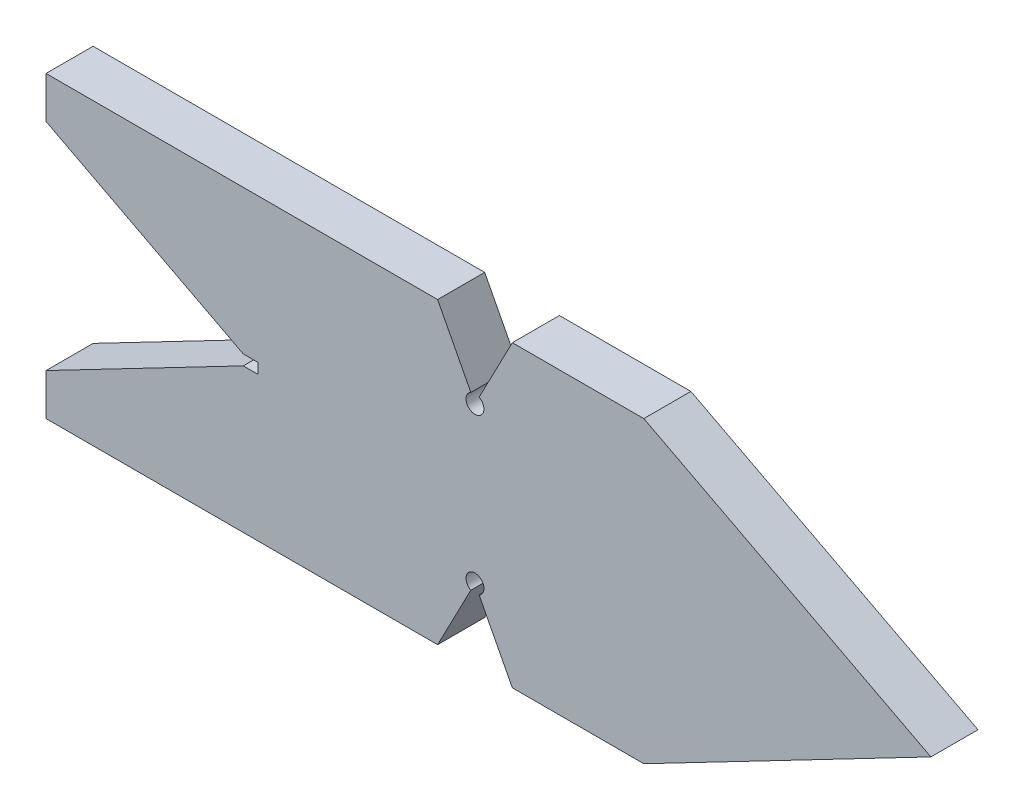
from build123d import *

# Parameters (mm, degrees)
BOSS_EXTRUDE1_DEPTH = 4
CUT_EXTRUDE1_DEPTH  = 1


with BuildPart() as part:
    # Sketch1 → Boss-Extrude1 (new body)
    with BuildSketch(Plane(origin=(0, 0, 0), x_dir=(-1, 0, 0), z_dir=(0, 0, -1))):
        with BuildLine():
            Line((-33.277650511, 0), (0, 0))
            Line((0, 0), (0, 3.534564477))
            Line((0, 3.534564477), (-16.761519211, 12.260059095))
            Line((-16.761519211, 12.260059095), (-18.031519211, 12.260059095))
            Line((-18.031519211, 12.260059095), (-18.031519211, 13.139940905))
            Line((-18.031519211, 13.139940905), (-16.761519211, 13.139940905))
            Line((-16.761519211, 13.139940905), (0, 21.865435523))
            Line((0, 21.865435523), (0, 25.4))
            Line((0, 25.4), (-33.277650511, 25.4))
            Line((-33.277650511, 25.4), (-36.100798067, 19.976784002))
            ThreePointArc((-36.100798067, 19.976784002), (-36.452650511, 18.538881747), (-36.804502954, 19.976784002))
            Line((-36.804502954, 19.976784002), (-39.627650511, 25.4))
            Line((-39.627650511, 25.4), (-50.8, 25.4))
            Line((-50.8, 25.4), (-75.196473013, 12.7))
            Line((-75.196473013, 12.7), (-50.8, 0))
            Line((-50.8, 0), (-39.627650511, 0))
            Line((-39.627650511, 0), (-36.804502954, 5.423215998))
            ThreePointArc((-36.804502954, 5.423215998), (-36.452650511, 6.861118253), (-36.100798067, 5.423215998))
            Line((-36.100798067, 5.423215998), (-33.277650511, 0))
        make_face()
    extrude(amount=-BOSS_EXTRUDE1_DEPTH)

    # Sketch2 → Cut-Extrude1 (cut)
    with BuildSketch(Plane(origin=(0, 0, 0), x_dir=(-1, 0, 0), z_dir=(0, 0, -1))):
        with BuildLine():
            Line((-37.434135709, 15.206613971), (-37.434135709, 14.847639612))
            Line((-37.434135709, 14.847639612), (-38.624640517, 14.847639612))
            Line((-38.624640517, 14.847639612), (-38.81324228, 13.927066695))
            add(Edge.make_bspline(
                [(-38.81324228, 13.927066695), (-38.776186405, 13.937296967), (-38.70439651, 13.957116501), (-38.598436649, 13.979122271), (-38.497844445, 13.992387715), (-38.432569075, 13.994199026), (-38.400982664, 13.99507551)],
                knots=[0, 0, 0, 0, 1.100273476, 2.13160584, 3.095893838, 4, 4, 4, 4], degree=3))
            add(Edge.make_bspline(
                [(-38.400982664, 13.99507551), (-38.361898925, 13.994229574), (-38.285050527, 13.992566253), (-38.17261158, 13.976594404), (-38.065278687, 13.951454489), (-37.963276317, 13.916333967), (-37.866415766, 13.871424234), (-37.775588205, 13.815324294), (-37.689430292, 13.749790962), (-37.609487698, 13.67444595), (-37.53696339, 13.591524334), (-37.4731974, 13.502366463), (-37.41903481, 13.407838801), (-37.375474055, 13.307038192), (-37.340689721, 13.201079038), (-37.317537726, 13.088846456), (-37.302121017, 12.971398336), (-37.30039863, 12.891093766), (-37.299520325, 12.850143619)],
                knots=[0, 0, 0, 0, 1.052922333, 2.070308379, 3.05430497, 4.020497103, 4.973039431, 5.925935799, 6.892292201, 7.88610001, 8.88166317, 9.857072816, 10.836096531, 11.812156883, 12.81219415, 13.836441305, 14.89672472, 16, 16, 16, 16], degree=3))
            add(Edge.make_bspline(
                [(-37.299520325, 12.850143619), (-37.3001854, 12.821621398), (-37.301506563, 12.764962411), (-37.30822515, 12.68081821), (-37.321160866, 12.598455377), (-37.33852859, 12.517862985), (-37.361071008, 12.439193613), (-37.388360062, 12.362222085), (-37.42175609, 12.287427478), (-37.458387465, 12.214102083), (-37.499633943, 12.143903576), (-37.54541245, 12.078254589), (-37.593777942, 12.016170308), (-37.645819327, 11.958316575), (-37.702020322, 11.905073557), (-37.761700289, 11.856125276), (-37.824383008, 11.810643945), (-37.89103825, 11.77047575), (-37.960180733, 11.733512794), (-38.03280895, 11.703189257), (-38.107269651, 11.676078728), (-38.184634527, 11.654469201), (-38.264728339, 11.637536646), (-38.347683115, 11.626036046), (-38.433063785, 11.617659608), (-38.490938797, 11.617135251), (-38.520173369, 11.616870381)],
                knots=[0, 0, 0, 0, 1.056347294, 2.098418968, 3.122841568, 4.141288669, 5.149314143, 6.15115421, 7.162517403, 8.180376062, 9.185164535, 10.17417709, 11.141909838, 12.097768115, 13.052685741, 14.0056014, 14.954263652, 15.917497458, 16.885230207, 17.854509472, 18.828990115, 19.81800267, 20.826176721, 21.857883937, 22.917946725, 24, 24, 24, 24], degree=3))
            add(Edge.make_bspline(
                [(-38.520173369, 11.616870381), (-38.55504755, 11.617561219), (-38.623658381, 11.618920361), (-38.724178948, 11.633138847), (-38.820893554, 11.653502763), (-38.913023655, 11.684139033), (-39.001394919, 11.722526328), (-39.084817636, 11.771042499), (-39.165423412, 11.826021603), (-39.239935449, 11.890901956), (-39.309091563, 11.961817638), (-39.370998071, 12.038775279), (-39.426131648, 12.120504721), (-39.473609395, 12.207402875), (-39.514107416, 12.299241406), (-39.545922405, 12.396364407), (-39.57160076, 12.498264411), (-39.58246418, 12.568417921), (-39.587981863, 12.604049869)],
                knots=[0, 0, 0, 0, 1.0467383, 2.05933395, 3.04377827, 4.011590433, 4.970194871, 5.932262533, 6.905835911, 7.896367577, 8.894135286, 9.877477877, 10.858688626, 11.851381753, 12.8477658, 13.868841284, 14.917554742, 16, 16, 16, 16], degree=3))
            Line((-39.587981863, 12.604049869), (-39.273879299, 12.604049869))
            add(Edge.make_bspline(
                [(-39.273879299, 12.604049869), (-39.266150742, 12.570673416), (-39.251296025, 12.506522021), (-39.218690276, 12.41639068), (-39.178824401, 12.336071456), (-39.131420053, 12.264501873), (-39.074870022, 12.202092876), (-39.010340593, 12.146475814), (-38.93799287, 12.096300684), (-38.85759964, 12.054477917), (-38.772786561, 12.018809164), (-38.684019351, 11.995057469), (-38.593715005, 11.978356576), (-38.532636634, 11.976684815), (-38.501944203, 11.97584474)],
                knots=[0, 0, 0, 0, 1.136247022, 2.183929868, 3.172523383, 4.106158343, 5.02341133, 5.958108904, 6.928429099, 7.938127109, 8.96079061, 9.975095812, 10.982467395, 12, 12, 12, 12], degree=3))
            add(Edge.make_bspline(
                [(-38.501944203, 11.97584474), (-38.471985758, 11.976665518), (-38.412997336, 11.978281637), (-38.32618595, 11.990720649), (-38.242373075, 12.00987822), (-38.162385719, 12.038548075), (-38.084824179, 12.073392793), (-38.011650409, 12.118107869), (-37.940747531, 12.169567888), (-37.874319398, 12.228524518), (-37.813479949, 12.293494212), (-37.759723827, 12.362971606), (-37.714946914, 12.437088452), (-37.677212805, 12.514561605), (-37.648559506, 12.596240162), (-37.628118525, 12.681741338), (-37.616115466, 12.771276318), (-37.614464286, 12.832345628), (-37.613622889, 12.863464933)],
                knots=[0, 0, 0, 0, 1.027316725, 2.022795036, 3.002884548, 3.971462791, 4.93288096, 5.914575861, 6.907176829, 7.935150275, 8.956128384, 9.956726525, 10.942570165, 11.921478529, 12.907843606, 13.90538589, 14.932640048, 16, 16, 16, 16], degree=3))
            add(Edge.make_bspline(
                [(-37.613622889, 12.863464933), (-37.614281368, 12.891540684), (-37.615570248, 12.946494973), (-37.626100818, 13.02689418), (-37.644417791, 13.102967222), (-37.669841671, 13.175081456), (-37.702121178, 13.243304898), (-37.741567491, 13.307707959), (-37.788920889, 13.367441792), (-37.843012777, 13.422534345), (-37.902270818, 13.47337922), (-37.967714561, 13.516723307), (-38.037974488, 13.553187224), (-38.112204087, 13.584655223), (-38.192168986, 13.607255968), (-38.276285618, 13.624223854), (-38.365462326, 13.634039216), (-38.426433014, 13.635401105), (-38.45777353, 13.636101151)],
                knots=[0, 0, 0, 0, 1.045622112, 2.046656509, 3.013763289, 3.955457236, 4.890082067, 5.820317437, 6.762574623, 7.722996705, 8.69280354, 9.665887285, 10.63943826, 11.638615906, 12.663482002, 13.728887084, 14.832589034, 16, 16, 16, 16], degree=3))
            add(Edge.make_bspline(
                [(-38.45777353, 13.636101151), (-38.484902459, 13.635520559), (-38.540916814, 13.634321786), (-38.626839641, 13.625495289), (-38.717131364, 13.611255995), (-38.811445859, 13.591669747), (-38.910066367, 13.566038671), (-39.012784768, 13.53532417), (-39.119817035, 13.498602171), (-39.191934759, 13.470869957), (-39.229007504, 13.456613971)],
                knots=[0, 0, 0, 0, 0.817624296, 1.688186739, 2.600797293, 3.572016777, 4.590301741, 5.671205678, 6.80286297, 8, 8, 8, 8], degree=3))
            Line((-39.229007504, 13.456613971), (-38.870033145, 15.206613971))
            Line((-38.870033145, 15.206613971), (-37.434135709, 15.206613971))
        make_face()
        with BuildLine():
            Line((-34.741828017, 15.206613971), (-34.741828017, 14.847639612))
            Line((-34.741828017, 14.847639612), (-35.932332825, 14.847639612))
            Line((-35.932332825, 14.847639612), (-36.120934587, 13.927066695))
            add(Edge.make_bspline(
                [(-36.120934587, 13.927066695), (-36.083878713, 13.937296967), (-36.012088817, 13.957116501), (-35.906128956, 13.979122271), (-35.805536753, 13.992387715), (-35.740261382, 13.994199026), (-35.708674972, 13.99507551)],
                knots=[0, 0, 0, 0, 1.100273476, 2.13160584, 3.095893838, 4, 4, 4, 4], degree=3))
            add(Edge.make_bspline(
                [(-35.708674972, 13.99507551), (-35.669591232, 13.994229574), (-35.592742835, 13.992566253), (-35.480303888, 13.976594404), (-35.372970995, 13.951454489), (-35.270968625, 13.916333967), (-35.174108074, 13.871424234), (-35.083280513, 13.815324294), (-34.9971226, 13.749790962), (-34.917180006, 13.67444595), (-34.844655697, 13.591524334), (-34.780889708, 13.502366463), (-34.726727117, 13.407838801), (-34.683166363, 13.307038192), (-34.648382028, 13.201079038), (-34.625230033, 13.088846456), (-34.609813324, 12.971398336), (-34.608090938, 12.891093766), (-34.607212632, 12.850143619)],
                knots=[0, 0, 0, 0, 1.052922333, 2.070308379, 3.05430497, 4.020497103, 4.973039431, 5.925935799, 6.892292201, 7.88610001, 8.88166317, 9.857072816, 10.836096531, 11.812156883, 12.81219415, 13.836441305, 14.89672472, 16, 16, 16, 16], degree=3))
            add(Edge.make_bspline(
                [(-34.607212632, 12.850143619), (-34.607877708, 12.821621398), (-34.60919887, 12.764962411), (-34.615917458, 12.68081821), (-34.628853174, 12.598455377), (-34.646220898, 12.517862985), (-34.668763316, 12.439193613), (-34.69605237, 12.362222085), (-34.729448397, 12.287427478), (-34.766079773, 12.214102083), (-34.807326251, 12.143903576), (-34.853104758, 12.078254589), (-34.901470249, 12.016170308), (-34.953511635, 11.958316575), (-35.00971263, 11.905073557), (-35.069392597, 11.856125276), (-35.132075316, 11.810643945), (-35.198730558, 11.77047575), (-35.267873041, 11.733512794), (-35.340501258, 11.703189257), (-35.414961959, 11.676078728), (-35.492326834, 11.654469201), (-35.572420647, 11.637536646), (-35.655375422, 11.626036046), (-35.740756092, 11.617659608), (-35.798631105, 11.617135251), (-35.827865677, 11.616870381)],
                knots=[0, 0, 0, 0, 1.056347294, 2.098418968, 3.122841568, 4.141288669, 5.149314143, 6.15115421, 7.162517403, 8.180376062, 9.185164535, 10.17417709, 11.141909838, 12.097768115, 13.052685741, 14.0056014, 14.954263652, 15.917497458, 16.885230207, 17.854509472, 18.828990115, 19.81800267, 20.826176721, 21.857883937, 22.917946725, 24, 24, 24, 24], degree=3))
            add(Edge.make_bspline(
                [(-35.827865677, 11.616870381), (-35.862739858, 11.617561219), (-35.931350689, 11.618920361), (-36.031871256, 11.633138847), (-36.128585861, 11.653502763), (-36.220715963, 11.684139033), (-36.309087226, 11.722526328), (-36.392509944, 11.771042499), (-36.47311572, 11.826021603), (-36.547627757, 11.890901956), (-36.61678387, 11.961817638), (-36.678690379, 12.038775279), (-36.733823956, 12.120504721), (-36.781301703, 12.207402875), (-36.821799724, 12.299241406), (-36.853614712, 12.396364407), (-36.879293067, 12.498264411), (-36.890156488, 12.568417921), (-36.895674171, 12.604049869)],
                knots=[0, 0, 0, 0, 1.0467383, 2.05933395, 3.04377827, 4.011590433, 4.970194871, 5.932262533, 6.905835911, 7.896367577, 8.894135286, 9.877477877, 10.858688626, 11.851381753, 12.8477658, 13.868841284, 14.917554742, 16, 16, 16, 16], degree=3))
            Line((-36.895674171, 12.604049869), (-36.581571607, 12.604049869))
            add(Edge.make_bspline(
                [(-36.581571607, 12.604049869), (-36.573843049, 12.570673416), (-36.558988333, 12.506522021), (-36.526382584, 12.41639068), (-36.486516709, 12.336071456), (-36.43911236, 12.264501873), (-36.38256233, 12.202092876), (-36.318032901, 12.146475814), (-36.245685178, 12.096300684), (-36.165291948, 12.054477917), (-36.080478869, 12.018809164), (-35.991711659, 11.995057469), (-35.901407312, 11.978356576), (-35.840328942, 11.976684815), (-35.809636511, 11.97584474)],
                knots=[0, 0, 0, 0, 1.136247022, 2.183929868, 3.172523383, 4.106158343, 5.02341133, 5.958108904, 6.928429099, 7.938127109, 8.96079061, 9.975095812, 10.982467395, 12, 12, 12, 12], degree=3))
            add(Edge.make_bspline(
                [(-35.809636511, 11.97584474), (-35.779678066, 11.976665518), (-35.720689644, 11.978281637), (-35.633878257, 11.990720649), (-35.550065383, 12.00987822), (-35.470078026, 12.038548075), (-35.392516487, 12.073392793), (-35.319342716, 12.118107869), (-35.248439839, 12.169567888), (-35.182011706, 12.228524518), (-35.121172256, 12.293494212), (-35.067416135, 12.362971606), (-35.022639222, 12.437088452), (-34.984905113, 12.514561605), (-34.956251814, 12.596240162), (-34.935810833, 12.681741338), (-34.923807774, 12.771276318), (-34.922156594, 12.832345628), (-34.921315196, 12.863464933)],
                knots=[0, 0, 0, 0, 1.027316725, 2.022795036, 3.002884548, 3.971462791, 4.93288096, 5.914575861, 6.907176829, 7.935150275, 8.956128384, 9.956726525, 10.942570165, 11.921478529, 12.907843606, 13.90538589, 14.932640048, 16, 16, 16, 16], degree=3))
            add(Edge.make_bspline(
                [(-34.921315196, 12.863464933), (-34.921973676, 12.891540684), (-34.923262556, 12.946494973), (-34.933793126, 13.02689418), (-34.952110098, 13.102967222), (-34.977533978, 13.175081456), (-35.009813486, 13.243304898), (-35.049259798, 13.307707959), (-35.096613196, 13.367441792), (-35.150705085, 13.422534345), (-35.209963126, 13.47337922), (-35.275406868, 13.516723307), (-35.345666795, 13.553187224), (-35.419896395, 13.584655223), (-35.499861293, 13.607255968), (-35.583977926, 13.624223854), (-35.673154634, 13.634039216), (-35.734125322, 13.635401105), (-35.765465837, 13.636101151)],
                knots=[0, 0, 0, 0, 1.045622112, 2.046656509, 3.013763289, 3.955457236, 4.890082067, 5.820317437, 6.762574623, 7.722996705, 8.69280354, 9.665887285, 10.63943826, 11.638615906, 12.663482002, 13.728887084, 14.832589034, 16, 16, 16, 16], degree=3))
            add(Edge.make_bspline(
                [(-35.765465837, 13.636101151), (-35.792594766, 13.635520559), (-35.848609122, 13.634321786), (-35.934531948, 13.625495289), (-36.024823671, 13.611255995), (-36.119138167, 13.591669747), (-36.217758675, 13.566038671), (-36.320477076, 13.53532417), (-36.427509342, 13.498602171), (-36.499627067, 13.470869957), (-36.536699812, 13.456613971)],
                knots=[0, 0, 0, 0, 0.817624296, 1.688186739, 2.600797293, 3.572016777, 4.590301741, 5.671205678, 6.80286297, 8, 8, 8, 8], degree=3))
            Line((-36.536699812, 13.456613971), (-36.177725453, 15.206613971))
            Line((-36.177725453, 15.206613971), (-34.741828017, 15.206613971))
        make_face()
    extrude(amount=-CUT_EXTRUDE1_DEPTH, mode=Mode.SUBTRACT)


solid = part.part
